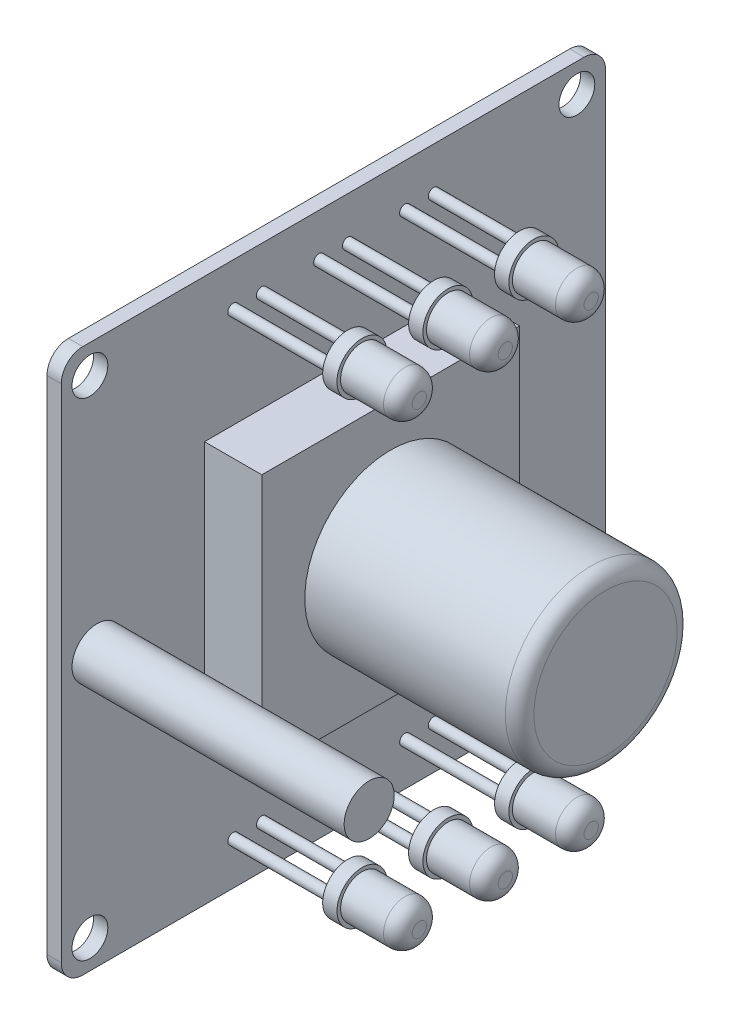
from build123d import *

# Parameters (mm, degrees)
SKETCH1_W           = 38
SKETCH1_H           = 38
SKETCH1_R           = 1.25
BOSS_EXTRUDE1_DEPTH = 1
FILLET1_R           = 1.5
SKETCH2_R           = 0.375
BOSS_EXTRUDE2_DEPTH = 8
SKETCH4_R           = 1.75
BOSS_EXTRUDE3_DEPTH = 1
SKETCH5_R           = 1.5
BOSS_EXTRUDE4_DEPTH = 5
FILLET2_R           = 1
SKETCH6_W           = 18
SKETCH6_H           = 18
BOSS_EXTRUDE5_DEPTH = 5
SKETCH7_R           = 6
BOSS_EXTRUDE6_DEPTH = 20
FILLET3_R           = 1
SKETCH8_R           = 1.75
BOSS_EXTRUDE7_DEPTH = 20


with BuildPart() as part:
    # Sketch1 → Boss-Extrude1 (new body)
    with BuildSketch(Plane.YZ):
        Rectangle(SKETCH1_W, SKETCH1_H)
        with Locations(Location((-17, 17, 0), (0, 0, 270))):
            Circle(SKETCH1_R, mode=Mode.SUBTRACT)
        with Locations(Location((17, 17, 0), (0, 0, 270))):
            Circle(SKETCH1_R, mode=Mode.SUBTRACT)
        with Locations(Location((-17, -17, 0), (0, 0, 270))):
            Circle(SKETCH1_R, mode=Mode.SUBTRACT)
        with Locations(Location((17, -17, 0), (0, 0, 270))):
            Circle(SKETCH1_R, mode=Mode.SUBTRACT)
    extrude(amount=BOSS_EXTRUDE1_DEPTH)

    # Fillet1
    fillet1_edges = [part.edges().sort_by_distance(p)[0] for p in [
        (0.5, -19, 19),
        (0.5, 19, 19),
        (0.5, 19, -19),
        (0.5, -19, -19),
    ]]
    fillet(fillet1_edges, radius=FILLET1_R)

    # Sketch2 → Boss-Extrude2 (add)
    with BuildSketch(Plane.YZ):
        with Locations(Location((-16, 7, 0), (0, 0, 270))):
            Circle(SKETCH2_R)
        with Locations(Location((-16, 5, 0), (0, 0, 270))):
            Circle(SKETCH2_R)
        with Locations(Location((-16, 1, 0), (0, 0, 270))):
            Circle(SKETCH2_R)
        with Locations(Location((-16, -1, 0), (0, 0, 90))):
            Circle(SKETCH2_R)
        with Locations(Location((-16, -5, 0), (0, 0, 90))):
            Circle(SKETCH2_R)
        with Locations(Location((-16, -7, 0), (0, 0, 90))):
            Circle(SKETCH2_R)
        with Locations(Location((16, -7, 0), (0, 0, 270))):
            Circle(SKETCH2_R)
        with Locations(Location((16, -5, 0), (0, 0, 270))):
            Circle(SKETCH2_R)
        with Locations(Location((16, -1, 0), (0, 0, 270))):
            Circle(SKETCH2_R)
        with Locations(Location((16, 1, 0), (0, 0, 90))):
            Circle(SKETCH2_R)
        with Locations(Location((16, 5, 0), (0, 0, 90))):
            Circle(SKETCH2_R)
        with Locations(Location((16, 7, 0), (0, 0, 90))):
            Circle(SKETCH2_R)
    extrude(amount=BOSS_EXTRUDE2_DEPTH)

    # Sketch4 → Boss-Extrude3 (add)
    with BuildSketch(Plane.YZ.offset(8)):
        with Locations(Location((-16, 6, 0), (0, 0, 270))):
            Circle(SKETCH4_R)
        with Locations(Location((-16, 0, 0), (0, 0, 270))):
            Circle(SKETCH4_R)
        with Locations(Location((-16, -6, 0), (0, 0, 270))):
            Circle(SKETCH4_R)
        with Locations(Location((16, -6, 0), (0, 0, 90))):
            Circle(SKETCH4_R)
        with Locations(Location((16, 0, 0), (0, 0, 90))):
            Circle(SKETCH4_R)
        with Locations(Location((16, 6, 0), (0, 0, 90))):
            Circle(SKETCH4_R)
    extrude(amount=BOSS_EXTRUDE3_DEPTH)

    # Sketch5 → Boss-Extrude4 (add)
    with BuildSketch(Plane.YZ.offset(8)):
        with Locations(Location((-16, 6, 0), (0, 0, 270))):
            Circle(SKETCH5_R)
        with Locations(Location((-16, 0, 0), (0, 0, 270))):
            Circle(SKETCH5_R)
        with Locations(Location((-16, -6, 0), (0, 0, 270))):
            Circle(SKETCH5_R)
        with Locations(Location((16, -6, 0), (0, 0, 90))):
            Circle(SKETCH5_R)
        with Locations(Location((16, 0, 0), (0, 0, 90))):
            Circle(SKETCH5_R)
        with Locations(Location((16, 6, 0), (0, 0, 90))):
            Circle(SKETCH5_R)
    extrude(amount=BOSS_EXTRUDE4_DEPTH)

    # Fillet2
    fillet2_edges = [part.edges().sort_by_distance(p)[0] for p in [
        (13, 16, 4.5),
        (13, 16, -1.5),
        (13, 16, -7.5),
        (13, -16, -4.5),
        (13, -16, 1.5),
        (13, -16, 7.5),
    ]]
    fillet(fillet2_edges, radius=FILLET2_R)

    # Sketch6 → Boss-Extrude5 (add)
    with BuildSketch(Plane.YZ):
        Rectangle(SKETCH6_W, SKETCH6_H)
    extrude(amount=BOSS_EXTRUDE5_DEPTH)

    # Sketch7 → Boss-Extrude6 (add)
    with BuildSketch(Plane.YZ):
        with Locations(Location((0, 0, 0), (0, 0, 270))):
            Circle(SKETCH7_R)
    extrude(amount=BOSS_EXTRUDE6_DEPTH)

    # Fillet3
    fillet3_edges = [part.edges().sort_by_distance(p)[0] for p in [
        (20, 0, 6),
    ]]
    fillet(fillet3_edges, radius=FILLET3_R)

    # Sketch8 → Boss-Extrude7 (add)
    with BuildSketch(Plane.YZ):
        with Locations(Location((0, 16.5, 0), (0, 0, 270))):
            Circle(SKETCH8_R)
    extrude(amount=BOSS_EXTRUDE7_DEPTH)


solid = part.part
